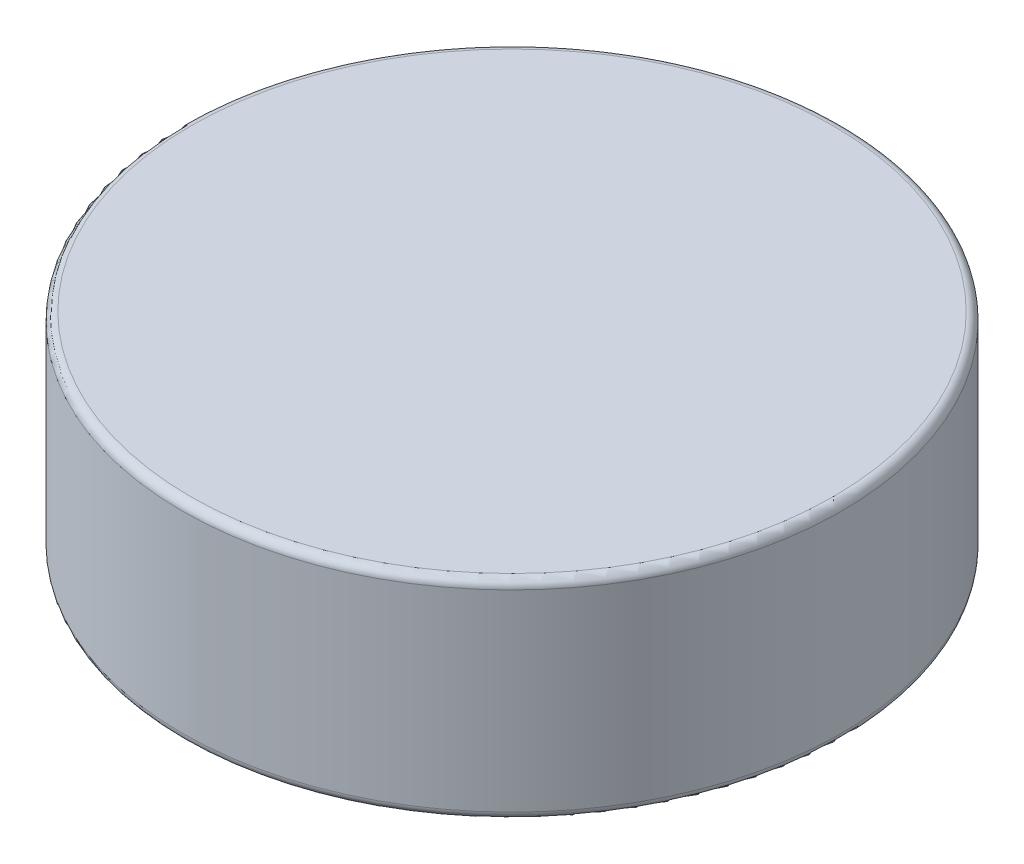
from build123d import *

# Parameters (mm, degrees)
SKETCH1_R           = 5.0038
BOSS_EXTRUDE1_DEPTH = 3.175
FILLET1_R           = 0.127


with BuildPart() as part:
    # Sketch1 → Boss-Extrude1 (new body)
    with BuildSketch(Plane(origin=(0, 0, 0), x_dir=(1, 0, 0), z_dir=(0, 1, 0))):
        with Locations(Location((0, 0, 0), (0, 0, 270))):
            Circle(SKETCH1_R)
    extrude(amount=BOSS_EXTRUDE1_DEPTH)

    # Fillet1
    fillet1_edges = [part.edges().sort_by_distance(p)[0] for p in [
        (0, 0, -5.0038),
        (0, 3.175, -5.0038),
    ]]
    fillet(fillet1_edges, radius=FILLET1_R)


solid = part.part
